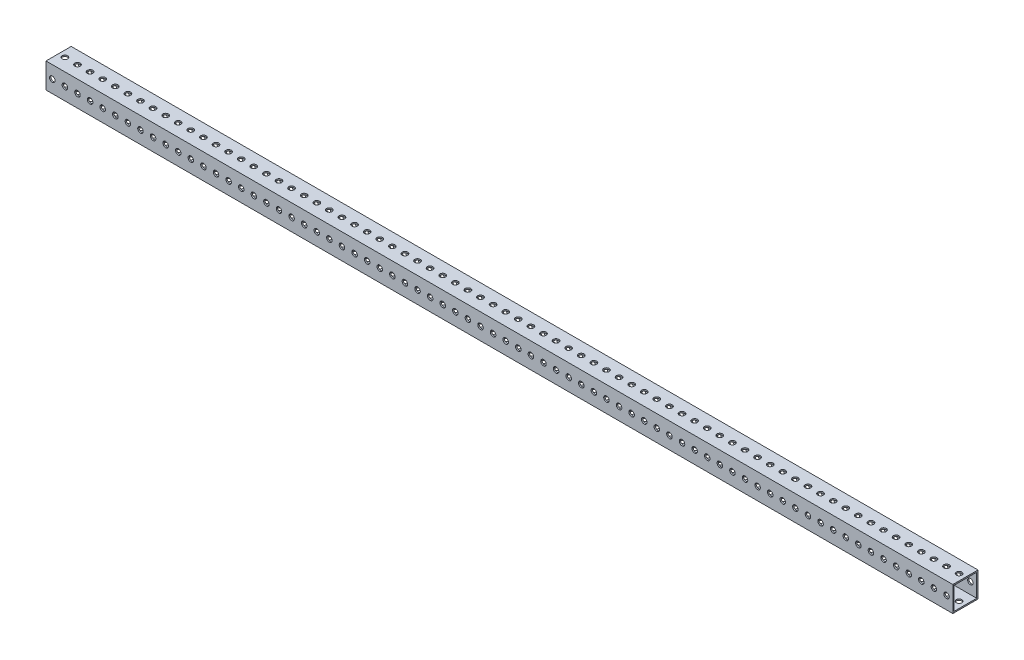
from build123d import *

# Parameters (mm, degrees)
SKETCH1_W                = 50.8
SKETCH1_H                = 50.8
SKETCH1_W_2              = 45.466
SKETCH1_H_2              = 45.466
EXTRUDE_THIN1_DEPTH      = 914.4
SKETCH2_R                = 5.55625
CUT_EXTRUDE1_DEPTH       = 918.217880332
LPATTERN1_COUNT          = 72
LPATTERN1_PITCH          = 25.4
MIRROR1_COPY_1_SKETCH_R  = 5.55625
MIRROR1_COPY_1_DEPTH     = 918.217880332
MIRROR1_COPY_2_SKETCH_R  = 5.55625
MIRROR1_COPY_2_DEPTH     = 918.217880332
MIRROR1_COPY_3_SKETCH_R  = 5.55625
MIRROR1_COPY_3_DEPTH     = 918.217880332
MIRROR1_COPY_4_SKETCH_R  = 5.55625
MIRROR1_COPY_4_DEPTH     = 918.217880332
MIRROR1_COPY_5_SKETCH_R  = 5.55625
MIRROR1_COPY_5_DEPTH     = 918.217880332
MIRROR1_COPY_6_SKETCH_R  = 5.55625
MIRROR1_COPY_6_DEPTH     = 918.217880332
MIRROR1_COPY_7_SKETCH_R  = 5.55625
MIRROR1_COPY_7_DEPTH     = 918.217880332
MIRROR1_COPY_8_SKETCH_R  = 5.55625
MIRROR1_COPY_8_DEPTH     = 918.217880332
MIRROR1_COPY_9_SKETCH_R  = 5.55625
MIRROR1_COPY_9_DEPTH     = 918.217880332
MIRROR1_COPY_10_SKETCH_R = 5.55625
MIRROR1_COPY_10_DEPTH    = 918.217880332
MIRROR1_COPY_11_SKETCH_R = 5.55625
MIRROR1_COPY_11_DEPTH    = 918.217880332
MIRROR1_COPY_12_SKETCH_R = 5.55625
MIRROR1_COPY_12_DEPTH    = 918.217880332
MIRROR1_COPY_13_SKETCH_R = 5.55625
MIRROR1_COPY_13_DEPTH    = 918.217880332
MIRROR1_COPY_14_SKETCH_R = 5.55625
MIRROR1_COPY_14_DEPTH    = 918.217880332
MIRROR1_COPY_15_SKETCH_R = 5.55625
MIRROR1_COPY_15_DEPTH    = 918.217880332
MIRROR1_COPY_16_SKETCH_R = 5.55625
MIRROR1_COPY_16_DEPTH    = 918.217880332
MIRROR1_COPY_17_SKETCH_R = 5.55625
MIRROR1_COPY_17_DEPTH    = 918.217880332
MIRROR1_COPY_18_SKETCH_R = 5.55625
MIRROR1_COPY_18_DEPTH    = 918.217880332
MIRROR1_COPY_19_SKETCH_R = 5.55625
MIRROR1_COPY_19_DEPTH    = 918.217880332
MIRROR1_COPY_20_SKETCH_R = 5.55625
MIRROR1_COPY_20_DEPTH    = 918.217880332
MIRROR1_COPY_21_SKETCH_R = 5.55625
MIRROR1_COPY_21_DEPTH    = 918.217880332
MIRROR1_COPY_22_SKETCH_R = 5.55625
MIRROR1_COPY_22_DEPTH    = 918.217880332
MIRROR1_COPY_23_SKETCH_R = 5.55625
MIRROR1_COPY_23_DEPTH    = 918.217880332
MIRROR1_COPY_24_SKETCH_R = 5.55625
MIRROR1_COPY_24_DEPTH    = 918.217880332
MIRROR1_COPY_25_SKETCH_R = 5.55625
MIRROR1_COPY_25_DEPTH    = 918.217880332
MIRROR1_COPY_26_SKETCH_R = 5.55625
MIRROR1_COPY_26_DEPTH    = 918.217880332
MIRROR1_COPY_27_SKETCH_R = 5.55625
MIRROR1_COPY_27_DEPTH    = 918.217880332
MIRROR1_COPY_28_SKETCH_R = 5.55625
MIRROR1_COPY_28_DEPTH    = 918.217880332
MIRROR1_COPY_29_SKETCH_R = 5.55625
MIRROR1_COPY_29_DEPTH    = 918.217880332
MIRROR1_COPY_30_SKETCH_R = 5.55625
MIRROR1_COPY_30_DEPTH    = 918.217880332
MIRROR1_COPY_31_SKETCH_R = 5.55625
MIRROR1_COPY_31_DEPTH    = 918.217880332
MIRROR1_COPY_32_SKETCH_R = 5.55625
MIRROR1_COPY_32_DEPTH    = 918.217880332
MIRROR1_COPY_33_SKETCH_R = 5.55625
MIRROR1_COPY_33_DEPTH    = 918.217880332
MIRROR1_COPY_34_SKETCH_R = 5.55625
MIRROR1_COPY_34_DEPTH    = 918.217880332
MIRROR1_COPY_35_SKETCH_R = 5.55625
MIRROR1_COPY_35_DEPTH    = 918.217880332
MIRROR1_COPY_36_SKETCH_R = 5.55625
MIRROR1_COPY_36_DEPTH    = 918.217880332
MIRROR1_COPY_37_SKETCH_R = 5.55625
MIRROR1_COPY_37_DEPTH    = 918.217880332
MIRROR1_COPY_38_SKETCH_R = 5.55625
MIRROR1_COPY_38_DEPTH    = 918.217880332
MIRROR1_COPY_39_SKETCH_R = 5.55625
MIRROR1_COPY_39_DEPTH    = 918.217880332
MIRROR1_COPY_40_SKETCH_R = 5.55625
MIRROR1_COPY_40_DEPTH    = 918.217880332
MIRROR1_COPY_41_SKETCH_R = 5.55625
MIRROR1_COPY_41_DEPTH    = 918.217880332
MIRROR1_COPY_42_SKETCH_R = 5.55625
MIRROR1_COPY_42_DEPTH    = 918.217880332
MIRROR1_COPY_43_SKETCH_R = 5.55625
MIRROR1_COPY_43_DEPTH    = 918.217880332
MIRROR1_COPY_44_SKETCH_R = 5.55625
MIRROR1_COPY_44_DEPTH    = 918.217880332
MIRROR1_COPY_45_SKETCH_R = 5.55625
MIRROR1_COPY_45_DEPTH    = 918.217880332
MIRROR1_COPY_46_SKETCH_R = 5.55625
MIRROR1_COPY_46_DEPTH    = 918.217880332
MIRROR1_COPY_47_SKETCH_R = 5.55625
MIRROR1_COPY_47_DEPTH    = 918.217880332
MIRROR1_COPY_48_SKETCH_R = 5.55625
MIRROR1_COPY_48_DEPTH    = 918.217880332
MIRROR1_COPY_49_SKETCH_R = 5.55625
MIRROR1_COPY_49_DEPTH    = 918.217880332
MIRROR1_COPY_50_SKETCH_R = 5.55625
MIRROR1_COPY_50_DEPTH    = 918.217880332
MIRROR1_COPY_51_SKETCH_R = 5.55625
MIRROR1_COPY_51_DEPTH    = 918.217880332
MIRROR1_COPY_52_SKETCH_R = 5.55625
MIRROR1_COPY_52_DEPTH    = 918.217880332
MIRROR1_COPY_53_SKETCH_R = 5.55625
MIRROR1_COPY_53_DEPTH    = 918.217880332
MIRROR1_COPY_54_SKETCH_R = 5.55625
MIRROR1_COPY_54_DEPTH    = 918.217880332
MIRROR1_COPY_55_SKETCH_R = 5.55625
MIRROR1_COPY_55_DEPTH    = 918.217880332
MIRROR1_COPY_56_SKETCH_R = 5.55625
MIRROR1_COPY_56_DEPTH    = 918.217880332
MIRROR1_COPY_57_SKETCH_R = 5.55625
MIRROR1_COPY_57_DEPTH    = 918.217880332
MIRROR1_COPY_58_SKETCH_R = 5.55625
MIRROR1_COPY_58_DEPTH    = 918.217880332
MIRROR1_COPY_59_SKETCH_R = 5.55625
MIRROR1_COPY_59_DEPTH    = 918.217880332
MIRROR1_COPY_60_SKETCH_R = 5.55625
MIRROR1_COPY_60_DEPTH    = 918.217880332
MIRROR1_COPY_61_SKETCH_R = 5.55625
MIRROR1_COPY_61_DEPTH    = 918.217880332
MIRROR1_COPY_62_SKETCH_R = 5.55625
MIRROR1_COPY_62_DEPTH    = 918.217880332
MIRROR1_COPY_63_SKETCH_R = 5.55625
MIRROR1_COPY_63_DEPTH    = 918.217880332
MIRROR1_COPY_64_SKETCH_R = 5.55625
MIRROR1_COPY_64_DEPTH    = 918.217880332
MIRROR1_COPY_65_SKETCH_R = 5.55625
MIRROR1_COPY_65_DEPTH    = 918.217880332
MIRROR1_COPY_66_SKETCH_R = 5.55625
MIRROR1_COPY_66_DEPTH    = 918.217880332
MIRROR1_COPY_67_SKETCH_R = 5.55625
MIRROR1_COPY_67_DEPTH    = 918.217880332
MIRROR1_COPY_68_SKETCH_R = 5.55625
MIRROR1_COPY_68_DEPTH    = 918.217880332
MIRROR1_COPY_69_SKETCH_R = 5.55625
MIRROR1_COPY_69_DEPTH    = 918.217880332
MIRROR1_COPY_70_SKETCH_R = 5.55625
MIRROR1_COPY_70_DEPTH    = 918.217880332
MIRROR1_COPY_71_SKETCH_R = 5.55625
MIRROR1_COPY_71_DEPTH    = 918.217880332


with BuildPart() as part:
    # Sketch1 → Extrude-Thin1 (new, symmetric)
    with BuildSketch(Plane(origin=(0, 0, 0), x_dir=(0, 0, -1), z_dir=(1, 0, 0))):
        with Locations((-25.4, 25.4)):
            Rectangle(SKETCH1_W, SKETCH1_H)
        with Locations((-25.4, 25.4)):
            Rectangle(SKETCH1_W_2, SKETCH1_H_2, mode=Mode.SUBTRACT)
    extrude(amount=EXTRUDE_THIN1_DEPTH, both=True)

    # Sketch2 → Cut-Extrude1 (cut, through all)
    with BuildSketch(Plane.XY):
        with Locations(Location((-901.7, 25.4, 0), (0, 0, 180))):
            Circle(SKETCH2_R)
    cut_extrude1 = extrude(amount=CUT_EXTRUDE1_DEPTH, mode=Mode.SUBTRACT)

    # LPattern1: Cut-Extrude1 ×72
    with Locations(*[(i * LPATTERN1_PITCH, 0, 0) for i in range(1, LPATTERN1_COUNT)]):
        add(cut_extrude1, mode=Mode.SUBTRACT)

    # Mirror1: Cut-Extrude1 across plane
    add(cut_extrude1.mirror(Plane(origin=(0, 0, 0), x_dir=(0, 0.7071067811865478, 0.7071067811865472), z_dir=(0, -0.7071067811865475, 0.7071067811865477))), mode=Mode.SUBTRACT)

    # Mirror1 copy 1 sketch → Mirror1 copy 1 (cut, through all)
    with BuildSketch(Plane(origin=(25.4, 0, 0), x_dir=(1, 0, 0), z_dir=(0, 1, 0))):
        with Locations((-901.7, -25.4)):
            Circle(MIRROR1_COPY_1_SKETCH_R)
    extrude(amount=MIRROR1_COPY_1_DEPTH, mode=Mode.SUBTRACT)

    # Mirror1 copy 2 sketch → Mirror1 copy 2 (cut, through all)
    with BuildSketch(Plane(origin=(50.8, 0, 0), x_dir=(1, 0, 0), z_dir=(0, 1, 0))):
        with Locations((-901.7, -25.4)):
            Circle(MIRROR1_COPY_2_SKETCH_R)
    extrude(amount=MIRROR1_COPY_2_DEPTH, mode=Mode.SUBTRACT)

    # Mirror1 copy 3 sketch → Mirror1 copy 3 (cut, through all)
    with BuildSketch(Plane(origin=(76.2, 0, 0), x_dir=(1, 0, 0), z_dir=(0, 1, 0))):
        with Locations((-901.7, -25.4)):
            Circle(MIRROR1_COPY_3_SKETCH_R)
    extrude(amount=MIRROR1_COPY_3_DEPTH, mode=Mode.SUBTRACT)

    # Mirror1 copy 4 sketch → Mirror1 copy 4 (cut, through all)
    with BuildSketch(Plane(origin=(101.6, 0, 0), x_dir=(1, 0, 0), z_dir=(0, 1, 0))):
        with Locations((-901.7, -25.4)):
            Circle(MIRROR1_COPY_4_SKETCH_R)
    extrude(amount=MIRROR1_COPY_4_DEPTH, mode=Mode.SUBTRACT)

    # Mirror1 copy 5 sketch → Mirror1 copy 5 (cut, through all)
    with BuildSketch(Plane(origin=(127, 0, 0), x_dir=(1, 0, 0), z_dir=(0, 1, 0))):
        with Locations((-901.7, -25.4)):
            Circle(MIRROR1_COPY_5_SKETCH_R)
    extrude(amount=MIRROR1_COPY_5_DEPTH, mode=Mode.SUBTRACT)

    # Mirror1 copy 6 sketch → Mirror1 copy 6 (cut, through all)
    with BuildSketch(Plane(origin=(152.4, 0, 0), x_dir=(1, 0, 0), z_dir=(0, 1, 0))):
        with Locations((-901.7, -25.4)):
            Circle(MIRROR1_COPY_6_SKETCH_R)
    extrude(amount=MIRROR1_COPY_6_DEPTH, mode=Mode.SUBTRACT)

    # Mirror1 copy 7 sketch → Mirror1 copy 7 (cut, through all)
    with BuildSketch(Plane(origin=(177.8, 0, 0), x_dir=(1, 0, 0), z_dir=(0, 1, 0))):
        with Locations((-901.7, -25.4)):
            Circle(MIRROR1_COPY_7_SKETCH_R)
    extrude(amount=MIRROR1_COPY_7_DEPTH, mode=Mode.SUBTRACT)

    # Mirror1 copy 8 sketch → Mirror1 copy 8 (cut, through all)
    with BuildSketch(Plane(origin=(203.2, 0, 0), x_dir=(1, 0, 0), z_dir=(0, 1, 0))):
        with Locations((-901.7, -25.4)):
            Circle(MIRROR1_COPY_8_SKETCH_R)
    extrude(amount=MIRROR1_COPY_8_DEPTH, mode=Mode.SUBTRACT)

    # Mirror1 copy 9 sketch → Mirror1 copy 9 (cut, through all)
    with BuildSketch(Plane(origin=(228.6, 0, 0), x_dir=(1, 0, 0), z_dir=(0, 1, 0))):
        with Locations((-901.7, -25.4)):
            Circle(MIRROR1_COPY_9_SKETCH_R)
    extrude(amount=MIRROR1_COPY_9_DEPTH, mode=Mode.SUBTRACT)

    # Mirror1 copy 10 sketch → Mirror1 copy 10 (cut, through all)
    with BuildSketch(Plane(origin=(254, 0, 0), x_dir=(1, 0, 0), z_dir=(0, 1, 0))):
        with Locations((-901.7, -25.4)):
            Circle(MIRROR1_COPY_10_SKETCH_R)
    extrude(amount=MIRROR1_COPY_10_DEPTH, mode=Mode.SUBTRACT)

    # Mirror1 copy 11 sketch → Mirror1 copy 11 (cut, through all)
    with BuildSketch(Plane(origin=(279.4, 0, 0), x_dir=(1, 0, 0), z_dir=(0, 1, 0))):
        with Locations((-901.7, -25.4)):
            Circle(MIRROR1_COPY_11_SKETCH_R)
    extrude(amount=MIRROR1_COPY_11_DEPTH, mode=Mode.SUBTRACT)

    # Mirror1 copy 12 sketch → Mirror1 copy 12 (cut, through all)
    with BuildSketch(Plane(origin=(304.8, 0, 0), x_dir=(1, 0, 0), z_dir=(0, 1, 0))):
        with Locations((-901.7, -25.4)):
            Circle(MIRROR1_COPY_12_SKETCH_R)
    extrude(amount=MIRROR1_COPY_12_DEPTH, mode=Mode.SUBTRACT)

    # Mirror1 copy 13 sketch → Mirror1 copy 13 (cut, through all)
    with BuildSketch(Plane(origin=(330.2, 0, 0), x_dir=(1, 0, 0), z_dir=(0, 1, 0))):
        with Locations((-901.7, -25.4)):
            Circle(MIRROR1_COPY_13_SKETCH_R)
    extrude(amount=MIRROR1_COPY_13_DEPTH, mode=Mode.SUBTRACT)

    # Mirror1 copy 14 sketch → Mirror1 copy 14 (cut, through all)
    with BuildSketch(Plane(origin=(355.6, 0, 0), x_dir=(1, 0, 0), z_dir=(0, 1, 0))):
        with Locations((-901.7, -25.4)):
            Circle(MIRROR1_COPY_14_SKETCH_R)
    extrude(amount=MIRROR1_COPY_14_DEPTH, mode=Mode.SUBTRACT)

    # Mirror1 copy 15 sketch → Mirror1 copy 15 (cut, through all)
    with BuildSketch(Plane(origin=(381, 0, 0), x_dir=(1, 0, 0), z_dir=(0, 1, 0))):
        with Locations((-901.7, -25.4)):
            Circle(MIRROR1_COPY_15_SKETCH_R)
    extrude(amount=MIRROR1_COPY_15_DEPTH, mode=Mode.SUBTRACT)

    # Mirror1 copy 16 sketch → Mirror1 copy 16 (cut, through all)
    with BuildSketch(Plane(origin=(406.4, 0, 0), x_dir=(1, 0, 0), z_dir=(0, 1, 0))):
        with Locations((-901.7, -25.4)):
            Circle(MIRROR1_COPY_16_SKETCH_R)
    extrude(amount=MIRROR1_COPY_16_DEPTH, mode=Mode.SUBTRACT)

    # Mirror1 copy 17 sketch → Mirror1 copy 17 (cut, through all)
    with BuildSketch(Plane(origin=(431.8, 0, 0), x_dir=(1, 0, 0), z_dir=(0, 1, 0))):
        with Locations((-901.7, -25.4)):
            Circle(MIRROR1_COPY_17_SKETCH_R)
    extrude(amount=MIRROR1_COPY_17_DEPTH, mode=Mode.SUBTRACT)

    # Mirror1 copy 18 sketch → Mirror1 copy 18 (cut, through all)
    with BuildSketch(Plane(origin=(457.2, 0, 0), x_dir=(1, 0, 0), z_dir=(0, 1, 0))):
        with Locations((-901.7, -25.4)):
            Circle(MIRROR1_COPY_18_SKETCH_R)
    extrude(amount=MIRROR1_COPY_18_DEPTH, mode=Mode.SUBTRACT)

    # Mirror1 copy 19 sketch → Mirror1 copy 19 (cut, through all)
    with BuildSketch(Plane(origin=(482.6, 0, 0), x_dir=(1, 0, 0), z_dir=(0, 1, 0))):
        with Locations((-901.7, -25.4)):
            Circle(MIRROR1_COPY_19_SKETCH_R)
    extrude(amount=MIRROR1_COPY_19_DEPTH, mode=Mode.SUBTRACT)

    # Mirror1 copy 20 sketch → Mirror1 copy 20 (cut, through all)
    with BuildSketch(Plane(origin=(508, 0, 0), x_dir=(1, 0, 0), z_dir=(0, 1, 0))):
        with Locations((-901.7, -25.4)):
            Circle(MIRROR1_COPY_20_SKETCH_R)
    extrude(amount=MIRROR1_COPY_20_DEPTH, mode=Mode.SUBTRACT)

    # Mirror1 copy 21 sketch → Mirror1 copy 21 (cut, through all)
    with BuildSketch(Plane(origin=(533.4, 0, 0), x_dir=(1, 0, 0), z_dir=(0, 1, 0))):
        with Locations((-901.7, -25.4)):
            Circle(MIRROR1_COPY_21_SKETCH_R)
    extrude(amount=MIRROR1_COPY_21_DEPTH, mode=Mode.SUBTRACT)

    # Mirror1 copy 22 sketch → Mirror1 copy 22 (cut, through all)
    with BuildSketch(Plane(origin=(558.8, 0, 0), x_dir=(1, 0, 0), z_dir=(0, 1, 0))):
        with Locations((-901.7, -25.4)):
            Circle(MIRROR1_COPY_22_SKETCH_R)
    extrude(amount=MIRROR1_COPY_22_DEPTH, mode=Mode.SUBTRACT)

    # Mirror1 copy 23 sketch → Mirror1 copy 23 (cut, through all)
    with BuildSketch(Plane(origin=(584.2, 0, 0), x_dir=(1, 0, 0), z_dir=(0, 1, 0))):
        with Locations((-901.7, -25.4)):
            Circle(MIRROR1_COPY_23_SKETCH_R)
    extrude(amount=MIRROR1_COPY_23_DEPTH, mode=Mode.SUBTRACT)

    # Mirror1 copy 24 sketch → Mirror1 copy 24 (cut, through all)
    with BuildSketch(Plane(origin=(609.6, 0, 0), x_dir=(1, 0, 0), z_dir=(0, 1, 0))):
        with Locations((-901.7, -25.4)):
            Circle(MIRROR1_COPY_24_SKETCH_R)
    extrude(amount=MIRROR1_COPY_24_DEPTH, mode=Mode.SUBTRACT)

    # Mirror1 copy 25 sketch → Mirror1 copy 25 (cut, through all)
    with BuildSketch(Plane(origin=(635, 0, 0), x_dir=(1, 0, 0), z_dir=(0, 1, 0))):
        with Locations((-901.7, -25.4)):
            Circle(MIRROR1_COPY_25_SKETCH_R)
    extrude(amount=MIRROR1_COPY_25_DEPTH, mode=Mode.SUBTRACT)

    # Mirror1 copy 26 sketch → Mirror1 copy 26 (cut, through all)
    with BuildSketch(Plane(origin=(660.4, 0, 0), x_dir=(1, 0, 0), z_dir=(0, 1, 0))):
        with Locations((-901.7, -25.4)):
            Circle(MIRROR1_COPY_26_SKETCH_R)
    extrude(amount=MIRROR1_COPY_26_DEPTH, mode=Mode.SUBTRACT)

    # Mirror1 copy 27 sketch → Mirror1 copy 27 (cut, through all)
    with BuildSketch(Plane(origin=(685.8, 0, 0), x_dir=(1, 0, 0), z_dir=(0, 1, 0))):
        with Locations((-901.7, -25.4)):
            Circle(MIRROR1_COPY_27_SKETCH_R)
    extrude(amount=MIRROR1_COPY_27_DEPTH, mode=Mode.SUBTRACT)

    # Mirror1 copy 28 sketch → Mirror1 copy 28 (cut, through all)
    with BuildSketch(Plane(origin=(711.2, 0, 0), x_dir=(1, 0, 0), z_dir=(0, 1, 0))):
        with Locations((-901.7, -25.4)):
            Circle(MIRROR1_COPY_28_SKETCH_R)
    extrude(amount=MIRROR1_COPY_28_DEPTH, mode=Mode.SUBTRACT)

    # Mirror1 copy 29 sketch → Mirror1 copy 29 (cut, through all)
    with BuildSketch(Plane(origin=(736.6, 0, 0), x_dir=(1, 0, 0), z_dir=(0, 1, 0))):
        with Locations((-901.7, -25.4)):
            Circle(MIRROR1_COPY_29_SKETCH_R)
    extrude(amount=MIRROR1_COPY_29_DEPTH, mode=Mode.SUBTRACT)

    # Mirror1 copy 30 sketch → Mirror1 copy 30 (cut, through all)
    with BuildSketch(Plane(origin=(762, 0, 0), x_dir=(1, 0, 0), z_dir=(0, 1, 0))):
        with Locations((-901.7, -25.4)):
            Circle(MIRROR1_COPY_30_SKETCH_R)
    extrude(amount=MIRROR1_COPY_30_DEPTH, mode=Mode.SUBTRACT)

    # Mirror1 copy 31 sketch → Mirror1 copy 31 (cut, through all)
    with BuildSketch(Plane(origin=(787.4, 0, 0), x_dir=(1, 0, 0), z_dir=(0, 1, 0))):
        with Locations((-901.7, -25.4)):
            Circle(MIRROR1_COPY_31_SKETCH_R)
    extrude(amount=MIRROR1_COPY_31_DEPTH, mode=Mode.SUBTRACT)

    # Mirror1 copy 32 sketch → Mirror1 copy 32 (cut, through all)
    with BuildSketch(Plane(origin=(812.8, 0, 0), x_dir=(1, 0, 0), z_dir=(0, 1, 0))):
        with Locations((-901.7, -25.4)):
            Circle(MIRROR1_COPY_32_SKETCH_R)
    extrude(amount=MIRROR1_COPY_32_DEPTH, mode=Mode.SUBTRACT)

    # Mirror1 copy 33 sketch → Mirror1 copy 33 (cut, through all)
    with BuildSketch(Plane(origin=(838.2, 0, 0), x_dir=(1, 0, 0), z_dir=(0, 1, 0))):
        with Locations((-901.7, -25.4)):
            Circle(MIRROR1_COPY_33_SKETCH_R)
    extrude(amount=MIRROR1_COPY_33_DEPTH, mode=Mode.SUBTRACT)

    # Mirror1 copy 34 sketch → Mirror1 copy 34 (cut, through all)
    with BuildSketch(Plane(origin=(863.6, 0, 0), x_dir=(1, 0, 0), z_dir=(0, 1, 0))):
        with Locations((-901.7, -25.4)):
            Circle(MIRROR1_COPY_34_SKETCH_R)
    extrude(amount=MIRROR1_COPY_34_DEPTH, mode=Mode.SUBTRACT)

    # Mirror1 copy 35 sketch → Mirror1 copy 35 (cut, through all)
    with BuildSketch(Plane(origin=(889, 0, 0), x_dir=(1, 0, 0), z_dir=(0, 1, 0))):
        with Locations((-901.7, -25.4)):
            Circle(MIRROR1_COPY_35_SKETCH_R)
    extrude(amount=MIRROR1_COPY_35_DEPTH, mode=Mode.SUBTRACT)

    # Mirror1 copy 36 sketch → Mirror1 copy 36 (cut, through all)
    with BuildSketch(Plane(origin=(914.4, 0, 0), x_dir=(1, 0, 0), z_dir=(0, 1, 0))):
        with Locations((-901.7, -25.4)):
            Circle(MIRROR1_COPY_36_SKETCH_R)
    extrude(amount=MIRROR1_COPY_36_DEPTH, mode=Mode.SUBTRACT)

    # Mirror1 copy 37 sketch → Mirror1 copy 37 (cut, through all)
    with BuildSketch(Plane(origin=(939.8, 0, 0), x_dir=(1, 0, 0), z_dir=(0, 1, 0))):
        with Locations((-901.7, -25.4)):
            Circle(MIRROR1_COPY_37_SKETCH_R)
    extrude(amount=MIRROR1_COPY_37_DEPTH, mode=Mode.SUBTRACT)

    # Mirror1 copy 38 sketch → Mirror1 copy 38 (cut, through all)
    with BuildSketch(Plane(origin=(965.2, 0, 0), x_dir=(1, 0, 0), z_dir=(0, 1, 0))):
        with Locations((-901.7, -25.4)):
            Circle(MIRROR1_COPY_38_SKETCH_R)
    extrude(amount=MIRROR1_COPY_38_DEPTH, mode=Mode.SUBTRACT)

    # Mirror1 copy 39 sketch → Mirror1 copy 39 (cut, through all)
    with BuildSketch(Plane(origin=(990.6, 0, 0), x_dir=(1, 0, 0), z_dir=(0, 1, 0))):
        with Locations((-901.7, -25.4)):
            Circle(MIRROR1_COPY_39_SKETCH_R)
    extrude(amount=MIRROR1_COPY_39_DEPTH, mode=Mode.SUBTRACT)

    # Mirror1 copy 40 sketch → Mirror1 copy 40 (cut, through all)
    with BuildSketch(Plane(origin=(1016, 0, 0), x_dir=(1, 0, 0), z_dir=(0, 1, 0))):
        with Locations((-901.7, -25.4)):
            Circle(MIRROR1_COPY_40_SKETCH_R)
    extrude(amount=MIRROR1_COPY_40_DEPTH, mode=Mode.SUBTRACT)

    # Mirror1 copy 41 sketch → Mirror1 copy 41 (cut, through all)
    with BuildSketch(Plane(origin=(1041.4, 0, 0), x_dir=(1, 0, 0), z_dir=(0, 1, 0))):
        with Locations((-901.7, -25.4)):
            Circle(MIRROR1_COPY_41_SKETCH_R)
    extrude(amount=MIRROR1_COPY_41_DEPTH, mode=Mode.SUBTRACT)

    # Mirror1 copy 42 sketch → Mirror1 copy 42 (cut, through all)
    with BuildSketch(Plane(origin=(1066.8, 0, 0), x_dir=(1, 0, 0), z_dir=(0, 1, 0))):
        with Locations((-901.7, -25.4)):
            Circle(MIRROR1_COPY_42_SKETCH_R)
    extrude(amount=MIRROR1_COPY_42_DEPTH, mode=Mode.SUBTRACT)

    # Mirror1 copy 43 sketch → Mirror1 copy 43 (cut, through all)
    with BuildSketch(Plane(origin=(1092.2, 0, 0), x_dir=(1, 0, 0), z_dir=(0, 1, 0))):
        with Locations((-901.7, -25.4)):
            Circle(MIRROR1_COPY_43_SKETCH_R)
    extrude(amount=MIRROR1_COPY_43_DEPTH, mode=Mode.SUBTRACT)

    # Mirror1 copy 44 sketch → Mirror1 copy 44 (cut, through all)
    with BuildSketch(Plane(origin=(1117.6, 0, 0), x_dir=(1, 0, 0), z_dir=(0, 1, 0))):
        with Locations((-901.7, -25.4)):
            Circle(MIRROR1_COPY_44_SKETCH_R)
    extrude(amount=MIRROR1_COPY_44_DEPTH, mode=Mode.SUBTRACT)

    # Mirror1 copy 45 sketch → Mirror1 copy 45 (cut, through all)
    with BuildSketch(Plane(origin=(1143, 0, 0), x_dir=(1, 0, 0), z_dir=(0, 1, 0))):
        with Locations((-901.7, -25.4)):
            Circle(MIRROR1_COPY_45_SKETCH_R)
    extrude(amount=MIRROR1_COPY_45_DEPTH, mode=Mode.SUBTRACT)

    # Mirror1 copy 46 sketch → Mirror1 copy 46 (cut, through all)
    with BuildSketch(Plane(origin=(1168.4, 0, 0), x_dir=(1, 0, 0), z_dir=(0, 1, 0))):
        with Locations((-901.7, -25.4)):
            Circle(MIRROR1_COPY_46_SKETCH_R)
    extrude(amount=MIRROR1_COPY_46_DEPTH, mode=Mode.SUBTRACT)

    # Mirror1 copy 47 sketch → Mirror1 copy 47 (cut, through all)
    with BuildSketch(Plane(origin=(1193.8, 0, 0), x_dir=(1, 0, 0), z_dir=(0, 1, 0))):
        with Locations((-901.7, -25.4)):
            Circle(MIRROR1_COPY_47_SKETCH_R)
    extrude(amount=MIRROR1_COPY_47_DEPTH, mode=Mode.SUBTRACT)

    # Mirror1 copy 48 sketch → Mirror1 copy 48 (cut, through all)
    with BuildSketch(Plane(origin=(1219.2, 0, 0), x_dir=(1, 0, 0), z_dir=(0, 1, 0))):
        with Locations((-901.7, -25.4)):
            Circle(MIRROR1_COPY_48_SKETCH_R)
    extrude(amount=MIRROR1_COPY_48_DEPTH, mode=Mode.SUBTRACT)

    # Mirror1 copy 49 sketch → Mirror1 copy 49 (cut, through all)
    with BuildSketch(Plane(origin=(1244.6, 0, 0), x_dir=(1, 0, 0), z_dir=(0, 1, 0))):
        with Locations((-901.7, -25.4)):
            Circle(MIRROR1_COPY_49_SKETCH_R)
    extrude(amount=MIRROR1_COPY_49_DEPTH, mode=Mode.SUBTRACT)

    # Mirror1 copy 50 sketch → Mirror1 copy 50 (cut, through all)
    with BuildSketch(Plane(origin=(1270, 0, 0), x_dir=(1, 0, 0), z_dir=(0, 1, 0))):
        with Locations((-901.7, -25.4)):
            Circle(MIRROR1_COPY_50_SKETCH_R)
    extrude(amount=MIRROR1_COPY_50_DEPTH, mode=Mode.SUBTRACT)

    # Mirror1 copy 51 sketch → Mirror1 copy 51 (cut, through all)
    with BuildSketch(Plane(origin=(1295.4, 0, 0), x_dir=(1, 0, 0), z_dir=(0, 1, 0))):
        with Locations((-901.7, -25.4)):
            Circle(MIRROR1_COPY_51_SKETCH_R)
    extrude(amount=MIRROR1_COPY_51_DEPTH, mode=Mode.SUBTRACT)

    # Mirror1 copy 52 sketch → Mirror1 copy 52 (cut, through all)
    with BuildSketch(Plane(origin=(1320.8, 0, 0), x_dir=(1, 0, 0), z_dir=(0, 1, 0))):
        with Locations((-901.7, -25.4)):
            Circle(MIRROR1_COPY_52_SKETCH_R)
    extrude(amount=MIRROR1_COPY_52_DEPTH, mode=Mode.SUBTRACT)

    # Mirror1 copy 53 sketch → Mirror1 copy 53 (cut, through all)
    with BuildSketch(Plane(origin=(1346.2, 0, 0), x_dir=(1, 0, 0), z_dir=(0, 1, 0))):
        with Locations((-901.7, -25.4)):
            Circle(MIRROR1_COPY_53_SKETCH_R)
    extrude(amount=MIRROR1_COPY_53_DEPTH, mode=Mode.SUBTRACT)

    # Mirror1 copy 54 sketch → Mirror1 copy 54 (cut, through all)
    with BuildSketch(Plane(origin=(1371.6, 0, 0), x_dir=(1, 0, 0), z_dir=(0, 1, 0))):
        with Locations((-901.7, -25.4)):
            Circle(MIRROR1_COPY_54_SKETCH_R)
    extrude(amount=MIRROR1_COPY_54_DEPTH, mode=Mode.SUBTRACT)

    # Mirror1 copy 55 sketch → Mirror1 copy 55 (cut, through all)
    with BuildSketch(Plane(origin=(1397, 0, 0), x_dir=(1, 0, 0), z_dir=(0, 1, 0))):
        with Locations((-901.7, -25.4)):
            Circle(MIRROR1_COPY_55_SKETCH_R)
    extrude(amount=MIRROR1_COPY_55_DEPTH, mode=Mode.SUBTRACT)

    # Mirror1 copy 56 sketch → Mirror1 copy 56 (cut, through all)
    with BuildSketch(Plane(origin=(1422.4, 0, 0), x_dir=(1, 0, 0), z_dir=(0, 1, 0))):
        with Locations((-901.7, -25.4)):
            Circle(MIRROR1_COPY_56_SKETCH_R)
    extrude(amount=MIRROR1_COPY_56_DEPTH, mode=Mode.SUBTRACT)

    # Mirror1 copy 57 sketch → Mirror1 copy 57 (cut, through all)
    with BuildSketch(Plane(origin=(1447.8, 0, 0), x_dir=(1, 0, 0), z_dir=(0, 1, 0))):
        with Locations((-901.7, -25.4)):
            Circle(MIRROR1_COPY_57_SKETCH_R)
    extrude(amount=MIRROR1_COPY_57_DEPTH, mode=Mode.SUBTRACT)

    # Mirror1 copy 58 sketch → Mirror1 copy 58 (cut, through all)
    with BuildSketch(Plane(origin=(1473.2, 0, 0), x_dir=(1, 0, 0), z_dir=(0, 1, 0))):
        with Locations((-901.7, -25.4)):
            Circle(MIRROR1_COPY_58_SKETCH_R)
    extrude(amount=MIRROR1_COPY_58_DEPTH, mode=Mode.SUBTRACT)

    # Mirror1 copy 59 sketch → Mirror1 copy 59 (cut, through all)
    with BuildSketch(Plane(origin=(1498.6, 0, 0), x_dir=(1, 0, 0), z_dir=(0, 1, 0))):
        with Locations((-901.7, -25.4)):
            Circle(MIRROR1_COPY_59_SKETCH_R)
    extrude(amount=MIRROR1_COPY_59_DEPTH, mode=Mode.SUBTRACT)

    # Mirror1 copy 60 sketch → Mirror1 copy 60 (cut, through all)
    with BuildSketch(Plane(origin=(1524, 0, 0), x_dir=(1, 0, 0), z_dir=(0, 1, 0))):
        with Locations((-901.7, -25.4)):
            Circle(MIRROR1_COPY_60_SKETCH_R)
    extrude(amount=MIRROR1_COPY_60_DEPTH, mode=Mode.SUBTRACT)

    # Mirror1 copy 61 sketch → Mirror1 copy 61 (cut, through all)
    with BuildSketch(Plane(origin=(1549.4, 0, 0), x_dir=(1, 0, 0), z_dir=(0, 1, 0))):
        with Locations((-901.7, -25.4)):
            Circle(MIRROR1_COPY_61_SKETCH_R)
    extrude(amount=MIRROR1_COPY_61_DEPTH, mode=Mode.SUBTRACT)

    # Mirror1 copy 62 sketch → Mirror1 copy 62 (cut, through all)
    with BuildSketch(Plane(origin=(1574.8, 0, 0), x_dir=(1, 0, 0), z_dir=(0, 1, 0))):
        with Locations((-901.7, -25.4)):
            Circle(MIRROR1_COPY_62_SKETCH_R)
    extrude(amount=MIRROR1_COPY_62_DEPTH, mode=Mode.SUBTRACT)

    # Mirror1 copy 63 sketch → Mirror1 copy 63 (cut, through all)
    with BuildSketch(Plane(origin=(1600.2, 0, 0), x_dir=(1, 0, 0), z_dir=(0, 1, 0))):
        with Locations((-901.7, -25.4)):
            Circle(MIRROR1_COPY_63_SKETCH_R)
    extrude(amount=MIRROR1_COPY_63_DEPTH, mode=Mode.SUBTRACT)

    # Mirror1 copy 64 sketch → Mirror1 copy 64 (cut, through all)
    with BuildSketch(Plane(origin=(1625.6, 0, 0), x_dir=(1, 0, 0), z_dir=(0, 1, 0))):
        with Locations((-901.7, -25.4)):
            Circle(MIRROR1_COPY_64_SKETCH_R)
    extrude(amount=MIRROR1_COPY_64_DEPTH, mode=Mode.SUBTRACT)

    # Mirror1 copy 65 sketch → Mirror1 copy 65 (cut, through all)
    with BuildSketch(Plane(origin=(1651, 0, 0), x_dir=(1, 0, 0), z_dir=(0, 1, 0))):
        with Locations((-901.7, -25.4)):
            Circle(MIRROR1_COPY_65_SKETCH_R)
    extrude(amount=MIRROR1_COPY_65_DEPTH, mode=Mode.SUBTRACT)

    # Mirror1 copy 66 sketch → Mirror1 copy 66 (cut, through all)
    with BuildSketch(Plane(origin=(1676.4, 0, 0), x_dir=(1, 0, 0), z_dir=(0, 1, 0))):
        with Locations((-901.7, -25.4)):
            Circle(MIRROR1_COPY_66_SKETCH_R)
    extrude(amount=MIRROR1_COPY_66_DEPTH, mode=Mode.SUBTRACT)

    # Mirror1 copy 67 sketch → Mirror1 copy 67 (cut, through all)
    with BuildSketch(Plane(origin=(1701.8, 0, 0), x_dir=(1, 0, 0), z_dir=(0, 1, 0))):
        with Locations((-901.7, -25.4)):
            Circle(MIRROR1_COPY_67_SKETCH_R)
    extrude(amount=MIRROR1_COPY_67_DEPTH, mode=Mode.SUBTRACT)

    # Mirror1 copy 68 sketch → Mirror1 copy 68 (cut, through all)
    with BuildSketch(Plane(origin=(1727.2, 0, 0), x_dir=(1, 0, 0), z_dir=(0, 1, 0))):
        with Locations((-901.7, -25.4)):
            Circle(MIRROR1_COPY_68_SKETCH_R)
    extrude(amount=MIRROR1_COPY_68_DEPTH, mode=Mode.SUBTRACT)

    # Mirror1 copy 69 sketch → Mirror1 copy 69 (cut, through all)
    with BuildSketch(Plane(origin=(1752.6, 0, 0), x_dir=(1, 0, 0), z_dir=(0, 1, 0))):
        with Locations((-901.7, -25.4)):
            Circle(MIRROR1_COPY_69_SKETCH_R)
    extrude(amount=MIRROR1_COPY_69_DEPTH, mode=Mode.SUBTRACT)

    # Mirror1 copy 70 sketch → Mirror1 copy 70 (cut, through all)
    with BuildSketch(Plane(origin=(1778, 0, 0), x_dir=(1, 0, 0), z_dir=(0, 1, 0))):
        with Locations((-901.7, -25.4)):
            Circle(MIRROR1_COPY_70_SKETCH_R)
    extrude(amount=MIRROR1_COPY_70_DEPTH, mode=Mode.SUBTRACT)

    # Mirror1 copy 71 sketch → Mirror1 copy 71 (cut, through all)
    with BuildSketch(Plane(origin=(1803.4, 0, 0), x_dir=(1, 0, 0), z_dir=(0, 1, 0))):
        with Locations((-901.7, -25.4)):
            Circle(MIRROR1_COPY_71_SKETCH_R)
    extrude(amount=MIRROR1_COPY_71_DEPTH, mode=Mode.SUBTRACT)


solid = part.part
